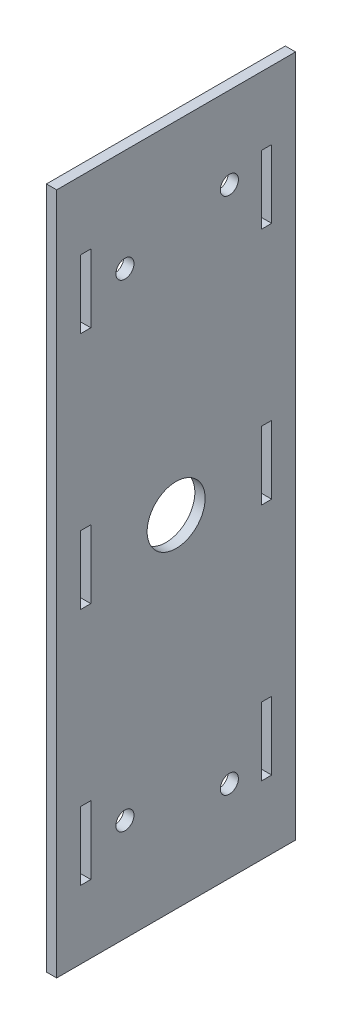
from build123d import *

# Parameters (mm, degrees)
SKETCH1_W           = 200
SKETCH1_H           = 70
SKETCH1_R           = 8.5
SKETCH1_R_2         = 2.65
SKETCH1_W_2         = 20
SKETCH1_H_2         = 3
BOSS_EXTRUDE1_DEPTH = 3


with BuildPart() as part:
    # Sketch1 → Boss-Extrude1 (new body)
    with BuildSketch(Plane.YZ):
        Rectangle(SKETCH1_W, SKETCH1_H)
        with Locations(Location((0, 0, 0), (0, 0, 270))):
            Circle(SKETCH1_R, mode=Mode.SUBTRACT)
        with Locations(Location((-76, -15.6, 0), (0, 0, 270))):
            Circle(SKETCH1_R_2, mode=Mode.SUBTRACT)
        with Locations(Location((76, -15.6, 0), (0, 0, 90))):
            Circle(SKETCH1_R_2, mode=Mode.SUBTRACT)
        with Locations(Location((-70, 15, 0), (0, 0, 270))):
            Circle(SKETCH1_R_2, mode=Mode.SUBTRACT)
        with Locations(Location((70, 15, 0), (0, 0, 90))):
            Circle(SKETCH1_R_2, mode=Mode.SUBTRACT)
        with Locations((-70, -26.5)):
            Rectangle(SKETCH1_W_2, SKETCH1_H_2, mode=Mode.SUBTRACT)
        with Locations((70, -26.5)):
            Rectangle(SKETCH1_W_2, SKETCH1_H_2, mode=Mode.SUBTRACT)
        with Locations((0, -26.5)):
            Rectangle(SKETCH1_W_2, SKETCH1_H_2, mode=Mode.SUBTRACT)
        with Locations((70, 26.5)):
            Rectangle(SKETCH1_W_2, SKETCH1_H_2, mode=Mode.SUBTRACT)
        with Locations((0, 26.5)):
            Rectangle(SKETCH1_W_2, SKETCH1_H_2, mode=Mode.SUBTRACT)
        with Locations((-70, 26.5)):
            Rectangle(SKETCH1_W_2, SKETCH1_H_2, mode=Mode.SUBTRACT)
    extrude(amount=BOSS_EXTRUDE1_DEPTH)


solid = part.part
